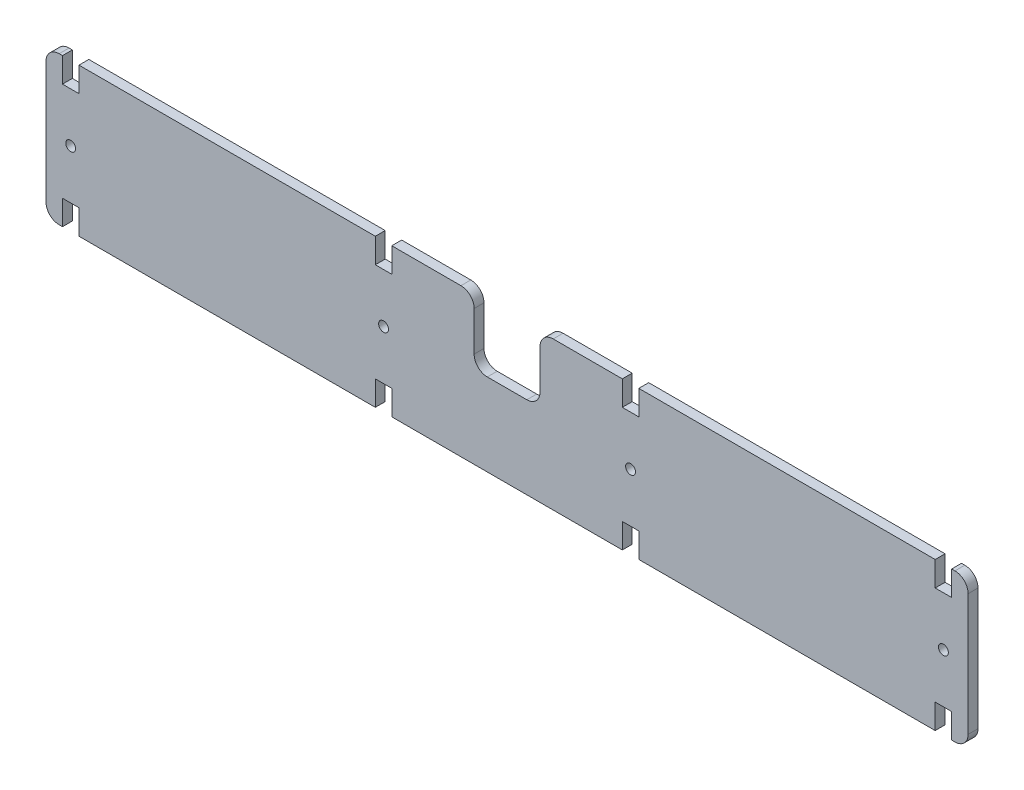
from build123d import *

# Parameters (mm, degrees)
ESQUISSE1_R        = 1.5
BOSS_EXTRU_1_DEPTH = 3
CONG_1_R           = 4


with BuildPart() as part:
    # Esquisse1 → Boss.-Extru.1 (new body)
    with BuildSketch(Plane.XY):
        Polygon((0, 0), (0, 45), (5, 45), (5, 37.5), (10, 37.5), (10, 45), (100, 45), (100, 37.5), (105, 37.5), (105, 45), (130, 45), (130, 25), (150, 25), (150, 45), (175, 45), (175, 37.5), (180, 37.5), (180, 45), (270, 45), (270, 37.5), (275, 37.5), (275, 45), (280, 45), (280, 0), (275, 0), (275, 7.5), (270, 7.5), (270, 0), (180, 0), (180, 7.5), (175, 7.5), (175, 0), (105, 0), (105, 7.5), (100, 7.5), (100, 0), (10, 0), (10, 7.5), (5, 7.5), (5, 0), align=None)
        with Locations((7.5, 22.5)):
            Circle(ESQUISSE1_R, mode=Mode.SUBTRACT)
        with Locations((102.5, 22.5)):
            Circle(ESQUISSE1_R, mode=Mode.SUBTRACT)
        with Locations((177.5, 22.5)):
            Circle(ESQUISSE1_R, mode=Mode.SUBTRACT)
        with Locations((272.5, 22.5)):
            Circle(ESQUISSE1_R, mode=Mode.SUBTRACT)
    extrude(amount=BOSS_EXTRU_1_DEPTH)

    # Congé1
    cong_1_edges = [part.edges().sort_by_distance(p)[0] for p in [
        (0, 0, 1.5),
        (0, 45, 1.5),
        (130, 45, 1.5),
        (130, 25, 1.5),
        (150, 25, 1.5),
        (150, 45, 1.5),
        (280, 45, 1.5),
        (280, 0, 1.5),
    ]]
    fillet(cong_1_edges, radius=CONG_1_R)


solid = part.part
